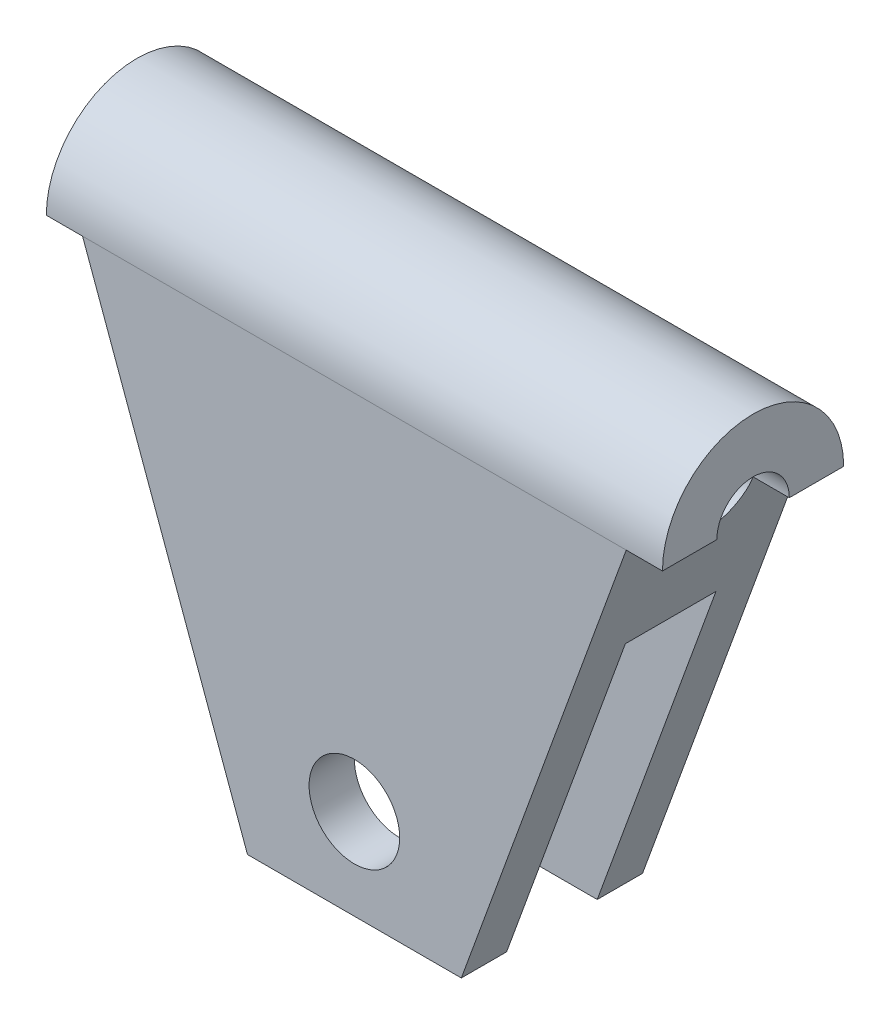
from build123d import *

# Parameters (mm, degrees)
BOSS_EXTRUDE1_DEPTH      = 100
BOSS_EXTRUDE2_DEPTH      = 320
BOSS_EXTRUDE2_DEPTH_BACK = 20
CUT_EXTRUDE1_DEPTH       = 419.210473327
CUT_EXTRUDE1_DEPTH_BACK  = 419.210473327
SKETCH3_3_R              = 20
CUT_EXTRUDE2_DEPTH       = 419.210473327
CUT_EXTRUDE2_DEPTH_BACK  = 419.210473327
SKETCH4_W                = 50
SKETCH4_H                = 180
SKETCH5_R                = 25
CUT_EXTRUDE5_DEPTH       = 419.210473327


with BuildPart() as part:
    # Sketch2 → Boss-Extrude1 (new body)
    with BuildSketch(Plane.XY):
        Polygon((0, 0), (300, 0), (209.007441433, -250), (90.992558567, -250), align=None)
    extrude(amount=BOSS_EXTRUDE1_DEPTH)

    # Sketch3 → Boss-Extrude2 (add, two sides: drawn at the far end of the back side and taken through both)
    with BuildSketch(Plane(origin=(0, 0, 0), x_dir=(0, 0, -1), z_dir=(1, 0, 0)).offset(-BOSS_EXTRUDE2_DEPTH_BACK)):
        with BuildLine():
            Line((-30, 0), (0, 0))
            ThreePointArc((0, 0), (-50, 50), (-100, 0))
            Line((-100, 0), (-70, 0))
            ThreePointArc((-70, 0), (-50, -20), (-30, 0))
        make_face()
    extrude(amount=BOSS_EXTRUDE2_DEPTH + BOSS_EXTRUDE2_DEPTH_BACK)

    # Sketch3<3> → Cut-Extrude1 (cut, two sides: drawn at the far end of the back side and taken through both)
    with BuildSketch(Plane(origin=(0, 0, 0), x_dir=(0, 0, -1), z_dir=(1, 0, 0)).offset(-CUT_EXTRUDE1_DEPTH_BACK)):
        with Locations((-50, 0)):
            Circle(SKETCH3_3_R)
    extrude(amount=CUT_EXTRUDE1_DEPTH + CUT_EXTRUDE1_DEPTH_BACK, mode=Mode.SUBTRACT)

    # Sketch4 → Cut-Extrude2 (cut, two sides: drawn at the far end of the back side and taken through both)
    with BuildSketch(Plane(origin=(0, 0, 0), x_dir=(0, 0, -1), z_dir=(1, 0, 0)).offset(-CUT_EXTRUDE2_DEPTH_BACK)):
        with Locations((-50, -160)):
            Rectangle(SKETCH4_W, SKETCH4_H)
    extrude(amount=CUT_EXTRUDE2_DEPTH + CUT_EXTRUDE2_DEPTH_BACK, mode=Mode.SUBTRACT)

    # Sketch5 → Cut-Extrude5 (cut, through all)
    with BuildSketch(Plane.XY):
        with Locations((150, -200)):
            Circle(SKETCH5_R)
    extrude(amount=CUT_EXTRUDE5_DEPTH, mode=Mode.SUBTRACT)


solid = part.part
